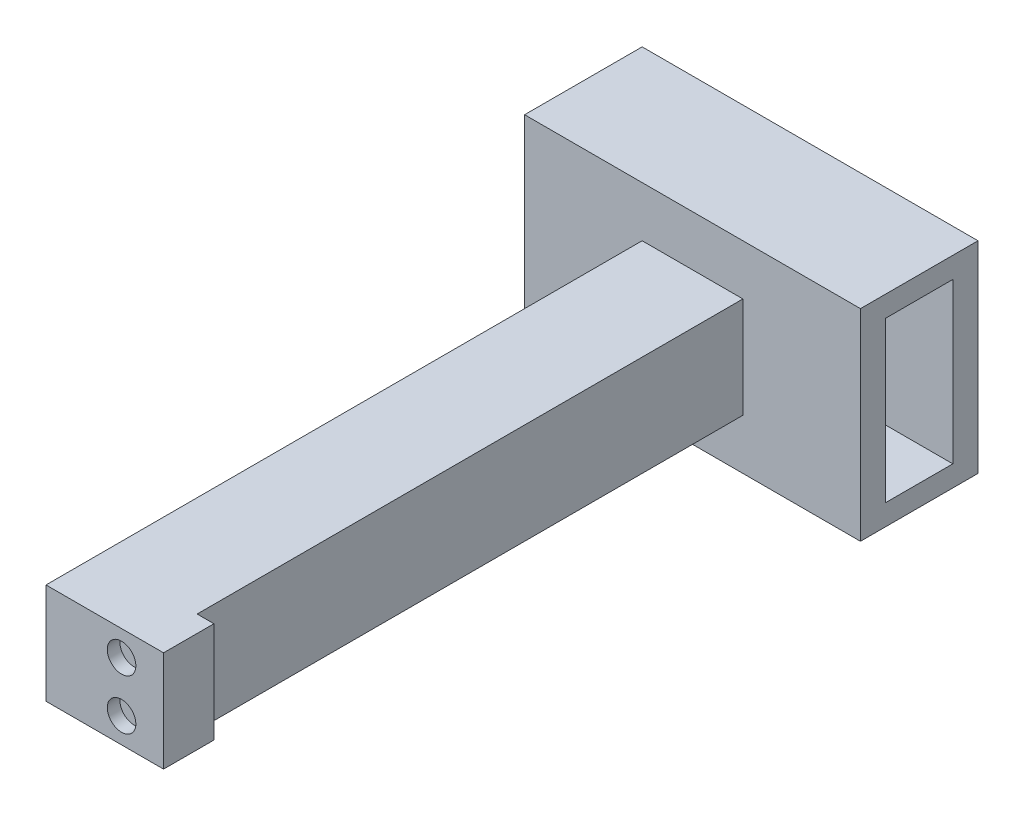
from build123d import *

# Parameters (mm, degrees)
OUTBOARD_FOOT_START                 = -6
SKETCH1_W                           = 14
SKETCH1_H                           = 12
SKETCH1_R                           = 1.7
OUTBOARD_FOOT_DEPTH                 = 6
DROP_WEB_START                      = -71
SKETCH2_W                           = 12
SKETCH2_H                           = 12
DROP_WEB_DEPTH                      = 69.5
CROSS_SLOT_BLOCK_START              = -85
SKETCH3_W                           = 40
SKETCH3_H                           = 24
CROSS_SLOT_BLOCK_DEPTH              = 14
X_FLOATING_Y_DRIVEN_SLOT_DEPTH      = 108.763630228
X_FLOATING_Y_DRIVEN_SLOT_DEPTH_BACK = 108.763630228
SKETCH4_W                           = 8
SKETCH4_H                           = 19.02


with BuildPart() as part:
    # Sketch1 → Outboard_Foot (new body)
    with BuildSketch(Plane.XY.offset(OUTBOARD_FOOT_START)):
        with Locations((-37, -20)):
            Rectangle(SKETCH1_W, SKETCH1_H)
        with Locations((-35, -23)):
            Circle(SKETCH1_R, mode=Mode.SUBTRACT)
        with Locations((-35, -17)):
            Circle(SKETCH1_R, mode=Mode.SUBTRACT)
    extrude(amount=OUTBOARD_FOOT_DEPTH)

    # Sketch2 → Drop_Web (add)
    with BuildSketch(Plane.XY.offset(DROP_WEB_START)):
        with Locations((-38, -20)):
            Rectangle(SKETCH2_W, SKETCH2_H)
    extrude(amount=DROP_WEB_DEPTH)

    # Sketch3 → Cross_Slot_Block (add)
    with BuildSketch(Plane.XY.offset(CROSS_SLOT_BLOCK_START)):
        with Locations((-38, -20)):
            Rectangle(SKETCH3_W, SKETCH3_H)
    extrude(amount=CROSS_SLOT_BLOCK_DEPTH)

    # Sketch4 → X_Floating_Y_Driven_Slot (cut, two sides: drawn at the far end of the back side and taken through both)
    with BuildSketch(Plane(origin=(0, 0, 0), x_dir=(0, 0, -1), z_dir=(1, 0, 0)).offset(-X_FLOATING_Y_DRIVEN_SLOT_DEPTH_BACK)):
        with Locations((78, -20)):
            Rectangle(SKETCH4_W, SKETCH4_H)
    extrude(amount=X_FLOATING_Y_DRIVEN_SLOT_DEPTH + X_FLOATING_Y_DRIVEN_SLOT_DEPTH_BACK, mode=Mode.SUBTRACT)


solid = part.part
